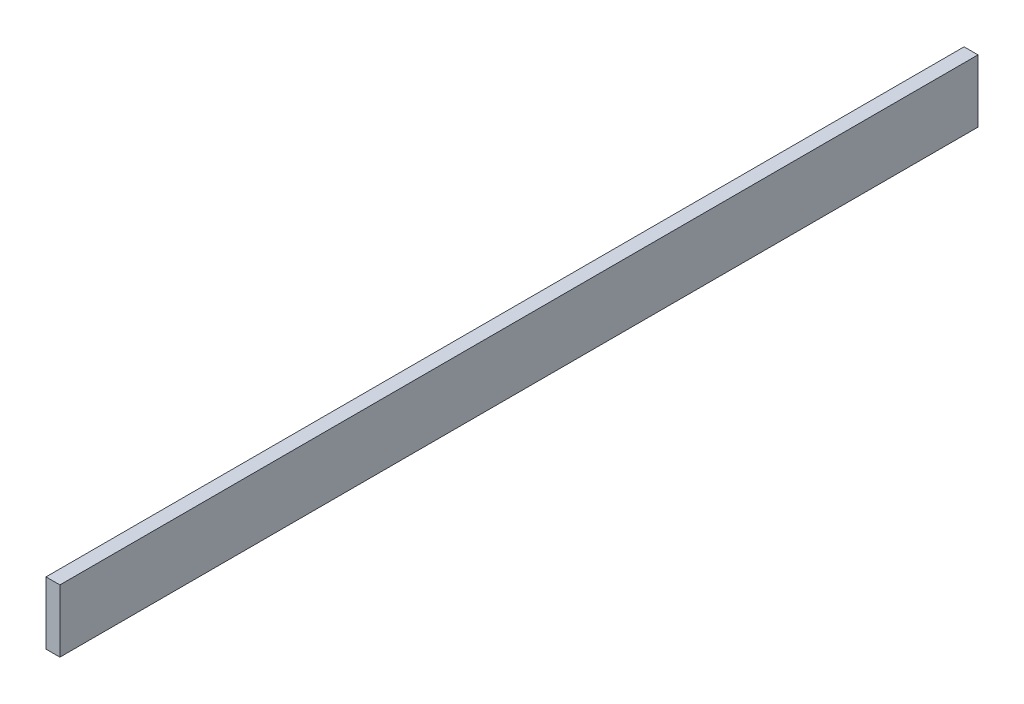
from build123d import *

# Parameters (mm, degrees)
ESQUISSE1_W        = 1320
ESQUISSE1_H        = 90
BOSS_EXTRU_1_DEPTH = 20


with BuildPart() as part:
    # Esquisse1 → Boss.-Extru.1 (new body)
    with BuildSketch(Plane(origin=(0, 0, 0), x_dir=(0, 0, -1), z_dir=(1, 0, 0))):
        with Locations((532.107417894, -16.230450587)):
            Rectangle(ESQUISSE1_W, ESQUISSE1_H)
    extrude(amount=BOSS_EXTRU_1_DEPTH)


solid = part.part
